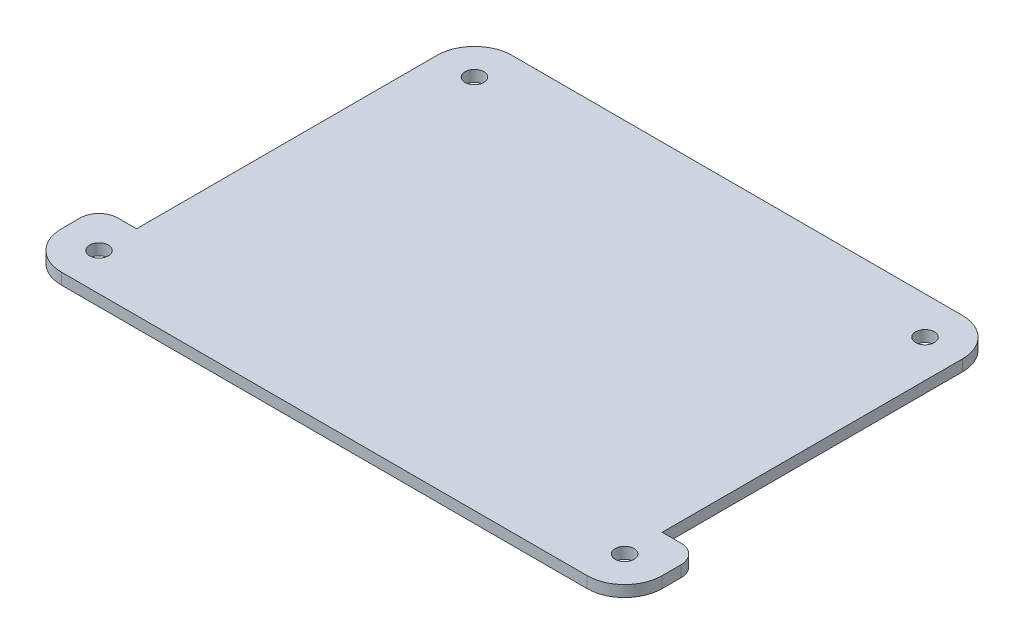
from build123d import *

# Parameters (mm, degrees)
CROQUIS1_R              = 2.5
SALIENTE_EXTRUIR1_DEPTH = 3


with BuildPart() as part:
    # Croquis1 → Saliente-Extruir1 (new body)
    with BuildSketch(Plane(origin=(0, 0, 0), x_dir=(1, 0, 0), z_dir=(0, 1, 0))):
        with BuildLine():
            Line((-60, 55), (60, 55))
            ThreePointArc((60, 55), (67.071067812, 52.071067812), (70, 45))
            Line((70, 45), (70, -35))
            Line((70, -35), (75, -35))
            ThreePointArc((75, -35), (78.535533906, -36.464466094), (80, -40))
            Line((80, -40), (80, -45))
            ThreePointArc((80, -45), (77.071067812, -52.071067812), (70, -55))
            Line((70, -55), (-70, -55))
            ThreePointArc((-70, -55), (-77.071067812, -52.071067812), (-80, -45))
            Line((-80, -45), (-80, -40))
            ThreePointArc((-80, -40), (-78.535533906, -36.464466094), (-75, -35))
            Line((-75, -35), (-70, -35))
            Line((-70, -35), (-70, 45))
            ThreePointArc((-70, 45), (-67.071067812, 52.071067812), (-60, 55))
        make_face()
        with Locations(Location((-60, 45, 0), (0, 0, 270))):
            Circle(CROQUIS1_R, mode=Mode.SUBTRACT)
        with Locations(Location((60, 45, 0), (0, 0, 270))):
            Circle(CROQUIS1_R, mode=Mode.SUBTRACT)
        with Locations(Location((-70, -45, 0), (0, 0, 270))):
            Circle(CROQUIS1_R, mode=Mode.SUBTRACT)
        with Locations(Location((70, -45, 0), (0, 0, 270))):
            Circle(CROQUIS1_R, mode=Mode.SUBTRACT)
    extrude(amount=SALIENTE_EXTRUIR1_DEPTH)


solid = part.part
